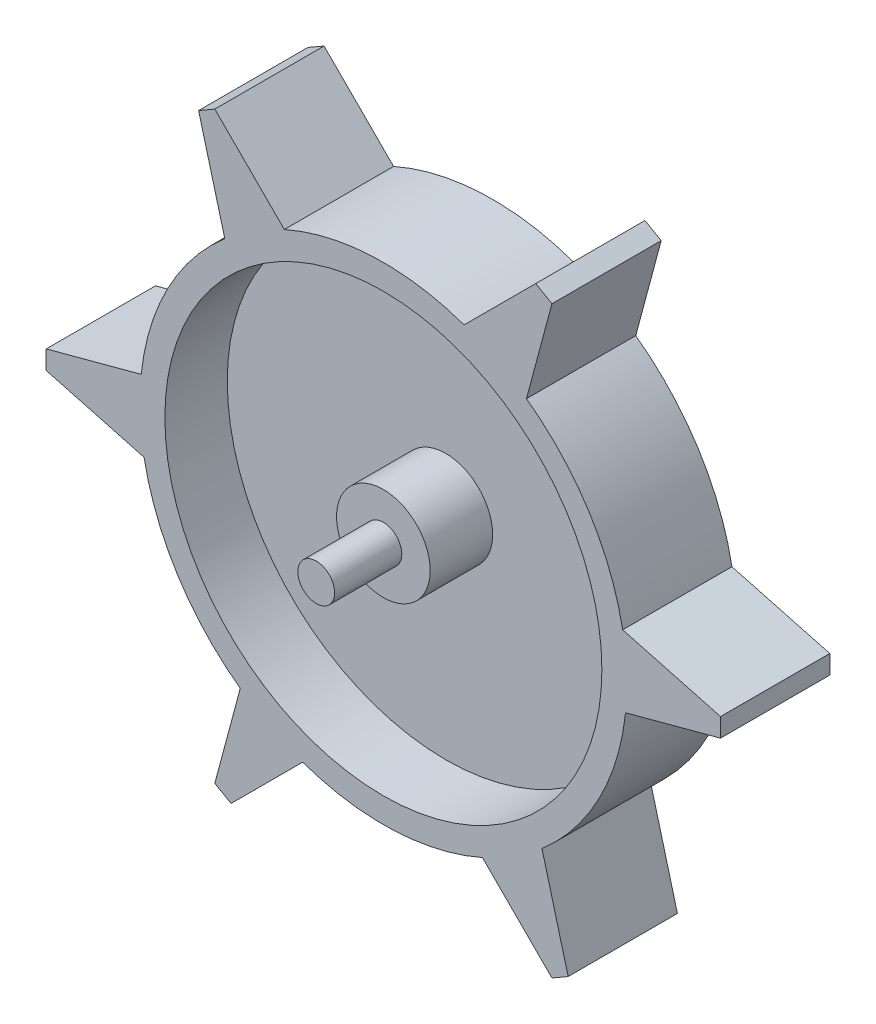
from build123d import *

# Parameters (mm, degrees)
SKETCH1_R                = 39
BOSS_EXTRUDE1_DEPTH      = 17.5
BOSS_EXTRUDE5_DEPTH      = 10.75
BOSS_EXTRUDE5_DEPTH_BACK = 28.25
SKETCH3_R                = 2.95
CUT_EXTRUDE1_START       = 10.75
CUT_EXTRUDE1_DEPTH       = 7.5
CIRPATTERN1_COUNT        = 6
SKETCH4_R                = 35
SKETCH4_R_2              = 7.5
CUT_EXTRUDE2_DEPTH       = 10


with BuildPart() as part:
    # Sketch1 → Boss-Extrude1 (new body)
    with BuildSketch(Plane.XY):
        Circle(SKETCH1_R)
        with BuildLine():
            Line((-54, 0), (-54, -3))
            Line((-54, -3), (-38.329847519, -7.198804702))
            ThreePointArc((-38.329847519, -7.198804702), (-38.968072448, -1.577760972), (-38.786367534, 4.076480533))
            Line((-38.786367534, 4.076480533), (-54, 0))
        make_face()
        with BuildLine():
            ThreePointArc((-38.786367534, 4.076480533), (-38.968072448, -1.577760972), (-38.329847519, -7.198804702))
            ThreePointArc((-38.329847519, -7.198804702), (3.614965197, -38.832100466), (39, 0))
            ThreePointArc((39, 0), (2.041037259, 38.946555264), (-38.786367534, 4.076480533))
        make_face()
    boss_extrude1 = extrude(amount=BOSS_EXTRUDE1_DEPTH)

    # Sketch3 → Boss-Extrude5 (add, two sides: drawn at the far end of the back side and taken through both)
    with BuildSketch(Plane.XY.offset(17.5).offset(-BOSS_EXTRUDE5_DEPTH_BACK)):
        Circle(SKETCH3_R)
    extrude(amount=BOSS_EXTRUDE5_DEPTH + BOSS_EXTRUDE5_DEPTH_BACK)

    # Sketch2 → Cut-Extrude1 (cut)
    with BuildSketch(Plane(origin=(0, 0, 0), x_dir=(-1, 0, 0), z_dir=(0, 0, -1)).offset(CUT_EXTRUDE1_START)):
        with BuildLine():
            Line((-1.223764683, -1.18), (1.223764683, -1.18))
            ThreePointArc((1.223764683, -1.18), (0, 1.7), (-1.223764683, -1.18))
        make_face()
    extrude(amount=-CUT_EXTRUDE1_DEPTH, mode=Mode.SUBTRACT)

    # CirPattern1: Boss-Extrude1 ×6 about axis
    cirpattern1_axis = Axis((0, 0, 0), (0, 0, 1))
    for i in range(1, CIRPATTERN1_COUNT):
        add(boss_extrude1.rotate(cirpattern1_axis, i * 360 / CIRPATTERN1_COUNT))

    # Sketch4 → Cut-Extrude2 (cut)
    with BuildSketch(Plane.XY.offset(17.5)):
        Circle(SKETCH4_R)
        Circle(SKETCH4_R_2, mode=Mode.SUBTRACT)
    extrude(amount=-CUT_EXTRUDE2_DEPTH, mode=Mode.SUBTRACT)


solid = part.part
